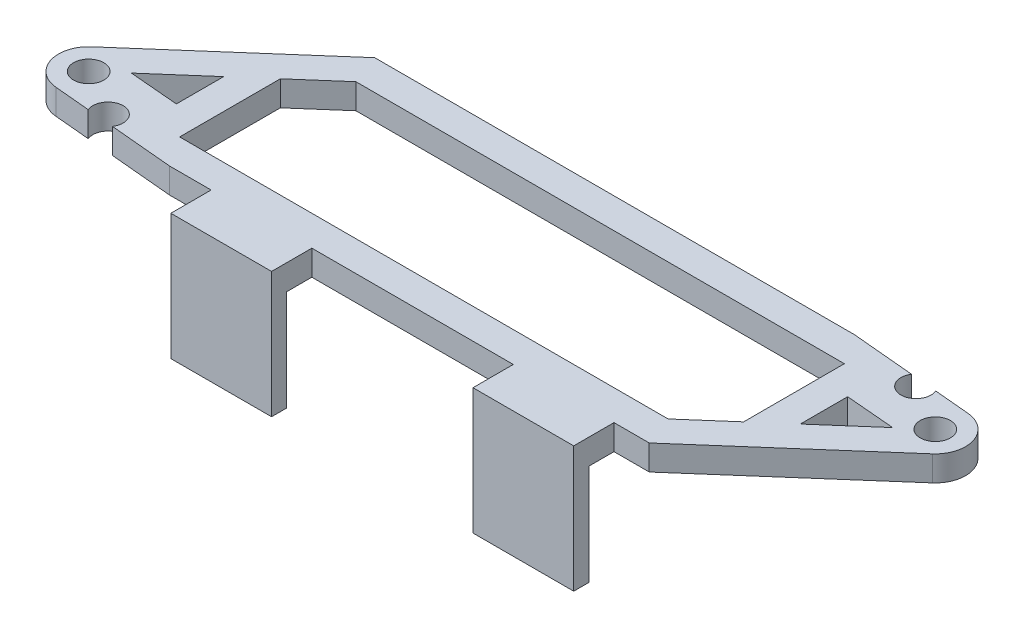
from build123d import *

# Parameters (mm, degrees)
SKETCH1_R           = 3
BOSS_EXTRUDE1_DEPTH = 5
SKETCH2_W           = 20
SKETCH2_H           = 3
BOSS_EXTRUDE2_DEPTH = 20


with BuildPart() as part:
    # Sketch1 → Boss-Extrude1 (new body)
    with BuildSketch(Plane(origin=(0, 0, 0), x_dir=(1, 0, 0), z_dir=(0, 1, 0))):
        with BuildLine():
            Line((-46.754410697, 33), (48.5, 33))
            Line((48.5, 33), (60.984651798, 31.862682764))
            ThreePointArc((60.984651798, 31.862682764), (63.227835275, 27.240115524), (66.269368613, 31.381259683))
            Line((66.269368613, 31.381259683), (73.34328665, 30.736845322))
            ThreePointArc((73.34328665, 30.736845322), (78.505606793, 26.614733634), (76.749984847, 20.246127381))
            Line((76.749984847, 20.246127381), (46.754410697, -6))
            Line((46.754410697, -6), (39.754410697, -6))
            Line((39.754410697, -6), (39.754410697, -14))
            Line((39.754410697, -14), (19.754410697, -14))
            Line((19.754410697, -14), (19.754410697, -6))
            Line((19.754410697, -6), (-20.245589303, -6))
            Line((-20.245589303, -6), (-20.245589303, -14))
            Line((-20.245589303, -14), (-40.245589303, -14))
            Line((-40.245589303, -14), (-40.245589303, -6))
            Line((-40.245589303, -6), (-48.5, -6))
            Line((-48.5, -6), (-60.984651798, -4.862682764))
            ThreePointArc((-60.984651798, -4.862682764), (-63.227835275, -0.240115524), (-66.269368613, -4.381259683))
            Line((-66.269368613, -4.381259683), (-73.34328665, -3.736845322))
            ThreePointArc((-73.34328665, -3.736845322), (-78.505606793, 0.385266366), (-76.749984847, 6.753872619))
            Line((-76.749984847, 6.753872619), (-46.754410697, 33))
        make_face()
        with Locations(Location((72.798957199, 24.76158755, 0), (0, 0, 270))):
            Circle(SKETCH1_R, mode=Mode.SUBTRACT)
        with Locations(Location((-72.798957199, 2.23841245, 0), (0, 0, 270))):
            Circle(SKETCH1_R, mode=Mode.SUBTRACT)
        Polygon((-44.5, 27), (52.5, 27), (52.5, 7), (44.5, 0), (-52.5, 0), (-52.5, 20), align=None, mode=Mode.SUBTRACT)
        Polygon((58.5, 21.65), (58.5, 12.25), (68.283497031, 20.810559902), align=None, mode=Mode.SUBTRACT)
        Polygon((-58.5, 14.75), (-68.283497031, 6.189440098), (-58.5, 5.35), align=None, mode=Mode.SUBTRACT)
    extrude(amount=BOSS_EXTRUDE1_DEPTH)

    # Sketch2 → Boss-Extrude2 (add)
    with BuildSketch(Plane.XZ):
        with Locations((-30.245589303, 12.5)):
            Rectangle(SKETCH2_W, SKETCH2_H)
        with Locations((29.754410697, 12.5)):
            Rectangle(SKETCH2_W, SKETCH2_H)
    extrude(amount=BOSS_EXTRUDE2_DEPTH)


solid = part.part
